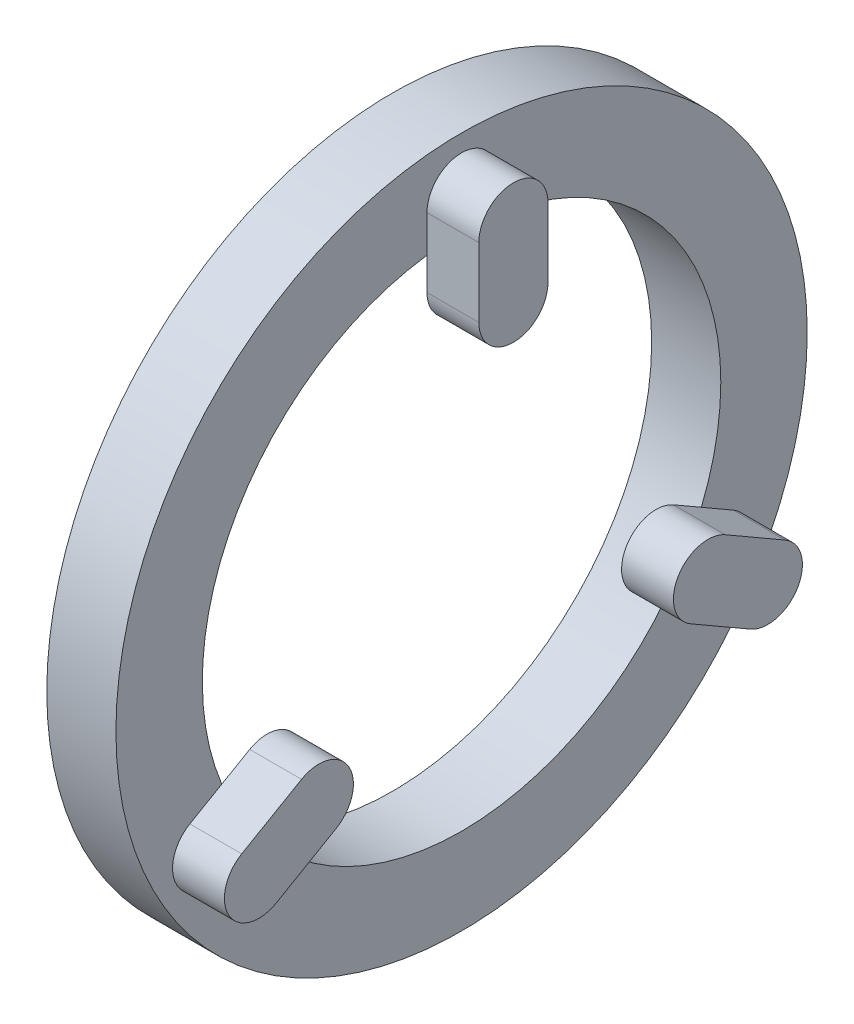
from build123d import *

# Parameters (mm, degrees)
SKETCH_1_R          = 10
EXTRUDE_1_DEPTH     = 2
SKETCH_3_R          = 7.5
CUT_EXTRUDE_1_DEPTH = 12.5
SKETCH_5_R          = 1
SKETCH_5_W          = 2
SKETCH_5_H          = 2
EXTRUDE_5_DEPTH     = 1.5


with BuildPart() as part:
    # 草图1 → 凸台-拉伸1 (new body)
    with BuildSketch(Plane(origin=(0, 0, 0), x_dir=(0, 0, -1), z_dir=(1, 0, 0))):
        Circle(SKETCH_1_R)
    extrude(amount=EXTRUDE_1_DEPTH)

    # 草图3 → 切除-拉伸1 (cut)
    with BuildSketch(Plane(origin=(2, 0, 0), x_dir=(0, 0, -1), z_dir=(1, 0, 0))):
        Circle(SKETCH_3_R)
    extrude(amount=-CUT_EXTRUDE_1_DEPTH, mode=Mode.SUBTRACT)

    # 草图5 → 凸台-拉伸5 (add)
    with BuildSketch(Plane(origin=(2, 0, 0), x_dir=(0, 0, -1), z_dir=(1, 0, 0))):
        with Locations((0, 8.5)):
            Circle(SKETCH_5_R)
        with Locations((7.361215932, -4.25)):
            Circle(SKETCH_5_R)
        with Locations((-7.361215932, -4.25)):
            Circle(SKETCH_5_R)
        with Locations((-5.629165125, -3.25)):
            Circle(SKETCH_5_R)
        with Locations((0, 6.5)):
            Circle(SKETCH_5_R)
        with Locations((5.629165125, -3.25)):
            Circle(SKETCH_5_R)
        Polygon((-7.861215932, -3.383974596), (-6.129165125, -2.383974596), (-5.129165125, -4.116025404), (-6.861215932, -5.116025404), align=None)
        with Locations((0, 7.5)):
            Rectangle(SKETCH_5_W, SKETCH_5_H)
        Polygon((6.129165125, -2.383974596), (7.861215932, -3.383974596), (6.861215932, -5.116025404), (5.129165125, -4.116025404), align=None)
    extrude(amount=EXTRUDE_5_DEPTH)


solid = part.part
